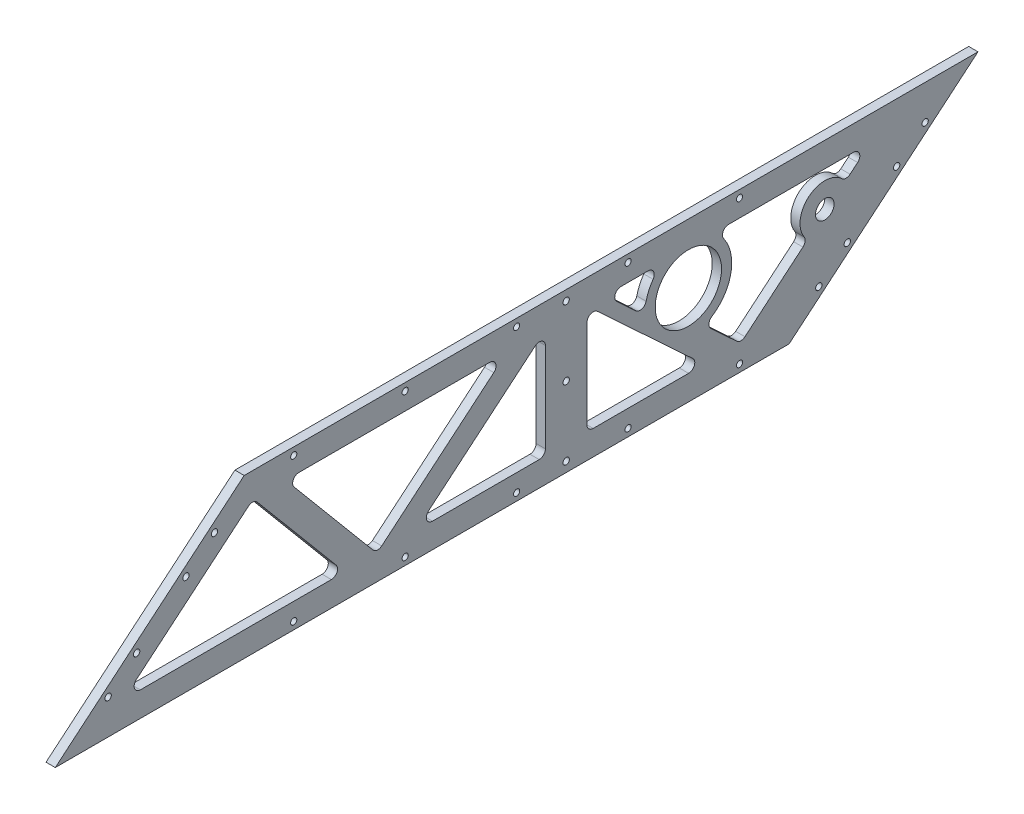
from build123d import *

# Parameters (mm, degrees)
BOSS_EXTRUDE1_DEPTH           = 4.7625
SKETCH2_R                     = 17
SKETCH2_R_2                   = 4.7625
GEARBOX_WITH_PRESS_FITS_DEPTH = 412.602247496
SKETCH3_R                     = 1.58115
CUT_EXTRUDE1_DEPTH            = 412.602247496
F_4_CLEARANCE_HOLE2_D         = 3.2639
F_4_CLEARANCE_HOLE2_DEPTH     = 28.702
F_4_CLEARANCE_HOLE2_TIP       = 0.980574487
F_4_CLEARANCE_HOLE1_D         = 3.2639
F_4_CLEARANCE_HOLE1_DEPTH     = 4.826
F_4_CLEARANCE_HOLE1_TIP       = 0.980574487
CUT_EXTRUDE2_DEPTH            = 412.602247496


with BuildPart() as part:
    # Sketch1 → Boss-Extrude1 (new body)
    with BuildSketch(Plane(origin=(0, 0, 0), x_dir=(0, 0, -1), z_dir=(1, 0, 0))):
        Polygon((33.297595377, -40.64), (312.697595377, -40.64), (345.995190754, -12.7), (409.563327383, 40.64), (312.697595377, 40.64), (33.297595377, 40.64), (0, 12.7), (-63.568136629, -40.64), align=None)
    extrude(amount=BOSS_EXTRUDE1_DEPTH)

    # Sketch2 → Gearbox (with Press fits) (cut, through all)
    with BuildSketch(Plane(origin=(4.7625, 0, 0), x_dir=(0, 0, -1), z_dir=(1, 0, 0))):
        with Locations((261.047997306, 10)):
            Circle(SKETCH2_R)
        with Locations((331.004197306, 10)):
            Circle(SKETCH2_R_2)
    extrude(amount=-GEARBOX_WITH_PRESS_FITS_DEPTH, mode=Mode.SUBTRACT)

    # Sketch3 → Cut-Extrude1 (cut, through all)
    with BuildSketch(Plane(origin=(4.7625, 0, 0), x_dir=(0, 0, -1), z_dir=(1, 0, 0))):
        with Locations((287.297595377, 36.83)):
            Circle(SKETCH3_R)
        with Locations((230.147595377, 36.83)):
            Circle(SKETCH3_R)
        with Locations((172.997595377, 36.83)):
            Circle(SKETCH3_R)
        with Locations((115.847595377, 36.83)):
            Circle(SKETCH3_R)
        with Locations((58.697595377, 36.83)):
            Circle(SKETCH3_R)
        with Locations((58.697595377, -36.83)):
            Circle(SKETCH3_R)
        with Locations((115.847595377, -36.83)):
            Circle(SKETCH3_R)
        with Locations((172.997595377, -36.83)):
            Circle(SKETCH3_R)
        with Locations((230.147595377, -36.83)):
            Circle(SKETCH3_R)
        with Locations((287.297595377, -36.83)):
            Circle(SKETCH3_R)
    extrude(amount=-CUT_EXTRUDE1_DEPTH, mode=Mode.SUBTRACT)

    # #4 Clearance Hole2
    with Locations(Plane(origin=(4.7625, 0, 0), x_dir=(0, 0, -1), z_dir=(1, 0, 0))):
        with Locations((327.962613202, -22.8575274), (342.555759844, -10.612423436), (367.850547356, 10.612423436), (382.443693997, 22.8575274), (-36.448503243, -22.8575274), (-21.855356602, -10.612423436), (3.43943091, 10.612423436), (18.032577552, 22.8575274)):
            Hole(F_4_CLEARANCE_HOLE2_D / 2, depth=F_4_CLEARANCE_HOLE2_DEPTH)
            with Locations((0, 0, -(F_4_CLEARANCE_HOLE2_DEPTH + F_4_CLEARANCE_HOLE2_TIP / 2))):  # 118° drill point
                Cone(0, F_4_CLEARANCE_HOLE2_D / 2, F_4_CLEARANCE_HOLE2_TIP, mode=Mode.SUBTRACT)

    # #4 Clearance Hole1
    with Locations(Plane(origin=(4.7625, 0, 0), x_dir=(0, 0, -1), z_dir=(1, 0, 0))):
        with Locations((198.397595377, 35.56), (198.397595377, -35.56), (198.397595377, 0)):
            Hole(F_4_CLEARANCE_HOLE1_D / 2, depth=F_4_CLEARANCE_HOLE1_DEPTH)
            with Locations((0, 0, -(F_4_CLEARANCE_HOLE1_DEPTH + F_4_CLEARANCE_HOLE1_TIP / 2))):  # 118° drill point
                Cone(0, F_4_CLEARANCE_HOLE1_D / 2, F_4_CLEARANCE_HOLE1_TIP, mode=Mode.SUBTRACT)

    # Sketch12 → Cut-Extrude2 (cut, through all)
    with BuildSketch(Plane(origin=(4.7625, 0, 0), x_dir=(0, 0, -1), z_dir=(1, 0, 0))):
        with BuildLine():
            Line((-21.992783256, -22.332808893), (35.487826245, 25.899149339))
            ThreePointArc((35.487826245, 25.899149339), (37.805396389, 26.629876399), (39.960868013, 25.507808893))
            Line((39.960868013, 25.507808893), (80.432286377, -22.724149339))
            ThreePointArc((80.432286377, -22.724149339), (80.877622494, -26.106812981), (78.00009527, -27.94))
            Line((78.00009527, -27.94), (-19.951932595, -27.94))
            ThreePointArc((-19.951932595, -27.94), (-22.935456666, -25.850913955), (-21.992783256, -22.332808893))
        make_face()
        with BuildLine():
            Line((209.054730082, 20.660543658), (209.054730082, -24.765))
            ThreePointArc((209.054730082, -24.765), (209.984666052, -27.01006403), (212.229730082, -27.94))
            Line((212.229730082, -27.94), (261.164292688, -27.94))
            ThreePointArc((261.164292688, -27.94), (264.119683707, -25.925296912), (263.324375254, -22.438056015))
            Line((263.324375254, -22.438056015), (214.389812648, 22.987487642))
            ThreePointArc((214.389812648, 22.987487642), (210.960406866, 23.570774503), (209.054730082, 20.660543658))
        make_face()
        with BuildLine():
            Line((58.875308292, 22.724149339), (99.346726656, -25.507808893))
            ThreePointArc((99.346726656, -25.507808893), (101.50219828, -26.629876399), (103.819768424, -25.899149339))
            Line((103.819768424, -25.899149339), (161.300377925, 22.332808893))
            ThreePointArc((161.300377925, 22.332808893), (162.243051335, 25.850913955), (159.259527264, 27.94))
            Line((159.259527264, 27.94), (61.307499399, 27.94))
            ThreePointArc((61.307499399, 27.94), (58.429972176, 26.106812981), (58.875308292, 22.724149339))
        make_face()
        with BuildLine():
            Line((127.827660064, -22.332808893), (182.524610012, 23.563381634))
            ThreePointArc((182.524610012, 23.563381634), (185.907273653, 24.008717751), (187.740460672, 21.131190527))
            Line((187.740460672, 21.131190527), (187.740460672, -24.765))
            ThreePointArc((187.740460672, -24.765), (186.810524703, -27.01006403), (184.565460672, -27.94))
            Line((184.565460672, -27.94), (129.868510725, -27.94))
            ThreePointArc((129.868510725, -27.94), (126.884986654, -25.850913955), (127.827660064, -22.332808893))
        make_face()
        with BuildLine():
            Line((224.315241868, 22.438056015), (234.126043645, 13.330771089))
            ThreePointArc((234.126043645, 13.330771089), (237.221277531, 12.623556705), (239.381360098, 14.950500689))
            ThreePointArc((239.381360098, 14.950500689), (240.77710315, 19.112709538), (242.96373966, 22.919375))
            ThreePointArc((242.96373966, 22.919375), (243.203436018, 26.217715668), (240.380274282, 27.94))
            Line((240.380274282, 27.94), (226.475324434, 27.94))
            ThreePointArc((226.475324434, 27.94), (223.519933415, 25.925296912), (224.315241868, 22.438056015))
        make_face()
        with BuildLine():
            Line((272.592180208, -13.712759564), (285.864427, -26.033274839))
            ThreePointArc((285.864427, -26.033274839), (287.944990379, -26.880334903), (290.065360226, -26.138521961))
            Line((290.065360226, -26.138521961), (319.802022888, -1.186499289))
            ThreePointArc((319.802022888, -1.186499289), (320.903182921, 0.789190119), (320.409777243, 2.996553454))
            ThreePointArc((320.409777243, 2.996553454), (322.840794663, 19.728764428), (339.7409475, 19.217331287))
            ThreePointArc((339.7409475, 19.217331287), (341.829097029, 18.348116929), (343.965985709, 19.089473002))
            Line((343.965985709, 19.089473002), (347.83124291, 22.332808893))
            ThreePointArc((347.83124291, 22.332808893), (348.77391632, 25.850913955), (345.790392249, 27.94))
            Line((345.790392249, 27.94), (281.71572033, 27.94))
            ThreePointArc((281.71572033, 27.94), (278.892558594, 26.217715668), (279.132254952, 22.919375))
            ThreePointArc((279.132254952, 22.919375), (282.871815818, 5.79624328), (273.039229591, -8.712588632))
            ThreePointArc((273.039229591, -8.712588632), (271.589877007, -11.103076724), (272.592180208, -13.712759564))
        make_face()
    extrude(amount=-CUT_EXTRUDE2_DEPTH, mode=Mode.SUBTRACT)


solid = part.part
